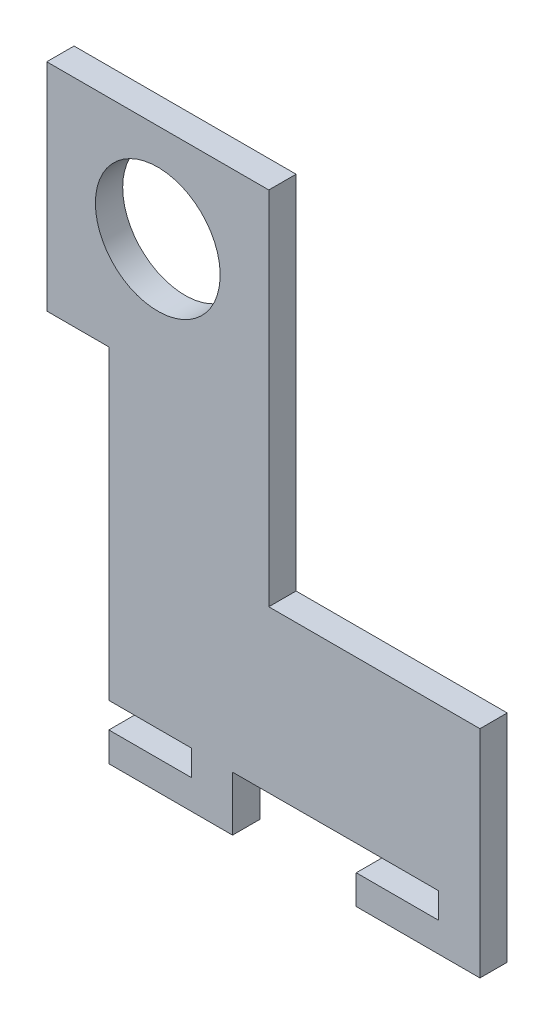
from build123d import *

# Parameters (mm, degrees)
SKETCH1_W           = 76.2
SKETCH1_H           = 96.655493252
BOSS_EXTRUDE1_DEPTH = 4.800000052
SKETCH2_R           = 10.974599971
CUT_EXTRUDE1_DEPTH  = 124.173716256
SKETCH3_W           = 76.2
SKETCH3_H           = 4.800000052
BOSS_EXTRUDE2_DEPTH = 4.826
SKETCH5_W           = 37.141404
SKETCH5_H           = 63.5
CUT_EXTRUDE3_DEPTH  = 124.173716256
SKETCH6_W           = 10.922
SKETCH6_H           = 63.5
CUT_EXTRUDE4_DEPTH  = 4.826
SKETCH7_W           = 14.502189266
SKETCH7_H           = 4.500000144
SKETCH7_W_2         = 14.502189267
CUT_EXTRUDE6_DEPTH  = 124.173716256


with BuildPart() as part:
    # Sketch1 → Boss-Extrude1 (new body)
    with BuildSketch(Plane.XY):
        with Locations((38.1, 48.327746626)):
            Rectangle(SKETCH1_W, SKETCH1_H)
    extrude(amount=BOSS_EXTRUDE1_DEPTH)

    # Sketch2 → Cut-Extrude1 (cut, through all)
    with BuildSketch(Plane(origin=(0, 0, 0), x_dir=(-1, 0, 0), z_dir=(0, 0, -1))):
        with Locations((-19.529298, 79.400775177)):
            Circle(SKETCH2_R)
    extrude(amount=-CUT_EXTRUDE1_DEPTH, mode=Mode.SUBTRACT)

    # Sketch3 → Boss-Extrude2 (add)
    with BuildSketch(Plane.XZ):
        with Locations((38.1, 2.400000026)):
            Rectangle(SKETCH3_W, SKETCH3_H)
    extrude(amount=BOSS_EXTRUDE2_DEPTH)

    # Sketch5 → Cut-Extrude3 (cut, through all)
    with BuildSketch(Plane(origin=(0, 0, 0), x_dir=(-1, 0, 0), z_dir=(0, 0, -1))):
        with Locations((-57.629298, 64.905493252)):
            Rectangle(SKETCH5_W, SKETCH5_H)
    extrude(amount=-CUT_EXTRUDE3_DEPTH, mode=Mode.SUBTRACT)

    # Sketch6 → Cut-Extrude4 (cut)
    with BuildSketch(Plane(origin=(0, 0, 0), x_dir=(-1, 0, 0), z_dir=(0, 0, -1))):
        with Locations((-5.461, 26.924)):
            Rectangle(SKETCH6_W, SKETCH6_H)
    extrude(amount=-CUT_EXTRUDE4_DEPTH, mode=Mode.SUBTRACT)

    # Sketch7 → Cut-Extrude6 (cut, through all)
    with BuildSketch(Plane(origin=(0, 0, 0), x_dir=(-1, 0, 0), z_dir=(0, 0, -1))):
        with Locations((-61.6917613, 2.575999928)):
            Rectangle(SKETCH7_W, SKETCH7_H)
        Polygon((-54.440666667, 0.325999856), (-54.440666667, -4.826), (-32.681333333, -4.826), (-32.681333333, 4.774000104), (-54.440666667, 4.826), align=None)
        with Locations((-18.173094633, 2.575999928)):
            Rectangle(SKETCH7_W_2, SKETCH7_H)
    extrude(amount=-CUT_EXTRUDE6_DEPTH, mode=Mode.SUBTRACT)


solid = part.part
